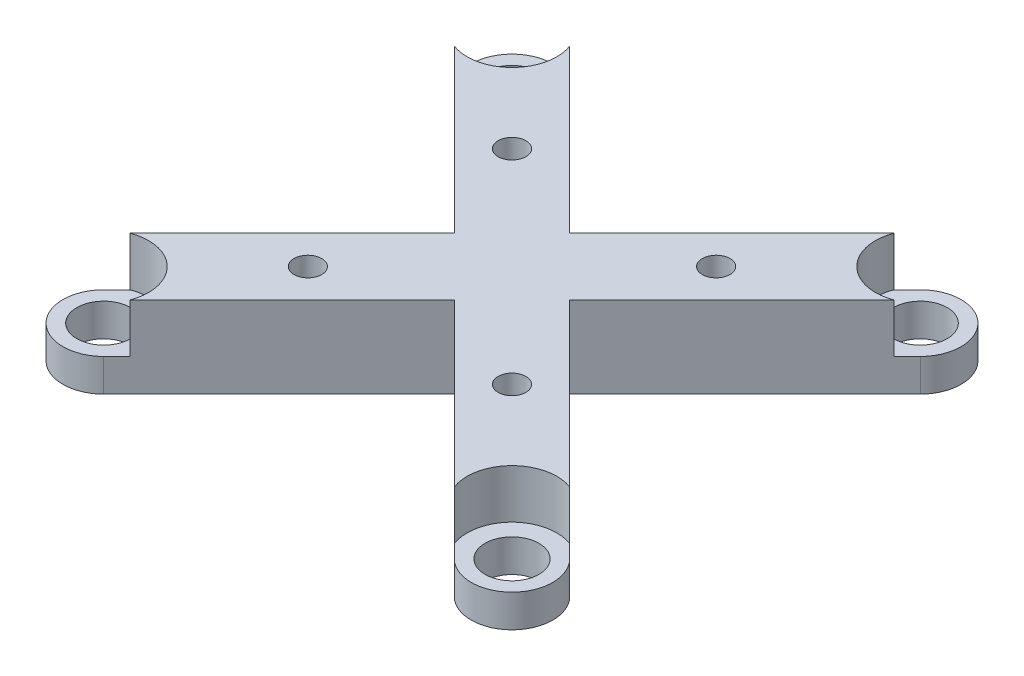
from build123d import *

# Parameters (mm, degrees)
EXTRUDE1_DEPTH                 = 10
CBORE_FOR_M6_SHCS2_D           = 6.6
CBORE_FOR_M6_SHCS2_CBORE_D     = 11
CBORE_FOR_M6_SHCS2_CBORE_DEPTH = 6
LPATTERN1_COUNT                = 2
LPATTERN1_PITCH                = 50
LPATTERN1_COUNT_DIR2           = 2
LPATTERN1_PITCH_DIR2           = 50
CBORE_FOR_M3_SHCS1_D           = 3.4
CBORE_FOR_M3_SHCS1_CBORE_D     = 6.5
CBORE_FOR_M3_SHCS1_CBORE_DEPTH = 3
LPATTERN2_COUNT                = 2
LPATTERN2_PITCH                = 25
LPATTERN2_COUNT_DIR2           = 2
LPATTERN2_PITCH_DIR2           = 25


with BuildPart() as part:
    # Sketch1 → Extrude1 (new body)
    with BuildSketch(Plane(origin=(0, 0, 0), x_dir=(1, 0, 0), z_dir=(0, 1, 0))):
        with BuildLine():
            Line((7.071067812, 0), (28.535533906, 21.464466094))
            ThreePointArc((28.535533906, 21.464466094), (28.535533906, 28.535533906), (21.464466094, 28.535533906))
            Line((21.464466094, 28.535533906), (0, 7.071067812))
            Line((0, 7.071067812), (-21.464466094, 28.535533906))
            ThreePointArc((-21.464466094, 28.535533906), (-28.535533906, 28.535533906), (-28.535533906, 21.464466094))
            Line((-28.535533906, 21.464466094), (-7.071067812, 0))
            Line((-7.071067812, 0), (-28.535533906, -21.464466094))
            ThreePointArc((-28.535533906, -21.464466094), (-28.535533906, -28.535533906), (-21.464466094, -28.535533906))
            Line((-21.464466094, -28.535533906), (0, -7.071067812))
            Line((0, -7.071067812), (21.464466094, -28.535533906))
            ThreePointArc((21.464466094, -28.535533906), (28.535533906, -28.535533906), (28.535533906, -21.464466094))
            Line((28.535533906, -21.464466094), (7.071067812, 0))
        make_face()
    extrude(amount=EXTRUDE1_DEPTH)

    # CBORE for M6 SHCS2 (through all)
    with Locations(Plane(origin=(-25, 10, -25), x_dir=(0, 0, 1), z_dir=(0, 1, 0))):
        with Locations((0, 0)):
            cbore_for_m6_shcs2 = CounterBoreHole(CBORE_FOR_M6_SHCS2_D / 2, CBORE_FOR_M6_SHCS2_CBORE_D / 2, CBORE_FOR_M6_SHCS2_CBORE_DEPTH)

    # LPattern1: CBORE for M6 SHCS2 2 × 2
    with Locations(*[(i * LPATTERN1_PITCH, 0, j * LPATTERN1_PITCH_DIR2) for i in range(LPATTERN1_COUNT) for j in range(LPATTERN1_COUNT_DIR2) if (i, j) != (0, 0)]):
        add(cbore_for_m6_shcs2, mode=Mode.SUBTRACT)

    # CBORE for M3 SHCS1 (through all)
    with Locations(Plane(origin=(-12.5, 0, 12.5), x_dir=(0, 0, -1), z_dir=(0, -1, 0))):
        with Locations((0, 0)):
            cbore_for_m3_shcs1 = CounterBoreHole(CBORE_FOR_M3_SHCS1_D / 2, CBORE_FOR_M3_SHCS1_CBORE_D / 2, CBORE_FOR_M3_SHCS1_CBORE_DEPTH)

    # LPattern2: CBORE for M3 SHCS1 2 × 2
    with Locations(*[(i * LPATTERN2_PITCH, 0, -j * LPATTERN2_PITCH_DIR2) for i in range(LPATTERN2_COUNT) for j in range(LPATTERN2_COUNT_DIR2) if (i, j) != (0, 0)]):
        add(cbore_for_m3_shcs1, mode=Mode.SUBTRACT)


solid = part.part
